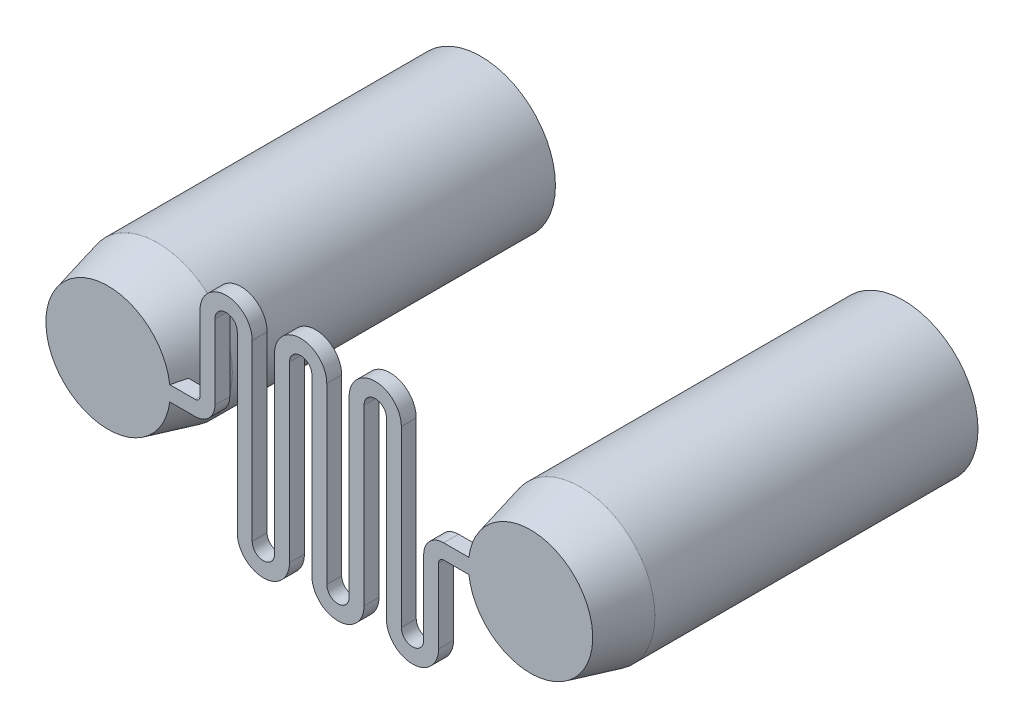
from build123d import *

# Parameters (mm, degrees)
BOSS_EXTRUDE1_DEPTH = 1.2
SKETCH5_R           = 5
CUT_EXTRUDE1_DEPTH  = 28


with BuildPart() as part:
    # Sketch2 → Boss-Extrude1 (new body)
    with BuildSketch(Plane.XY):
        with BuildLine():
            Line((-20.5, -0.6), (-13.5, -0.6))
            ThreePointArc((-13.5, -0.6), (-12.36862915, -0.13137085), (-11.9, 1))
            Line((-11.9, 1), (-11.9, 7))
            ThreePointArc((-11.9, 7), (-11, 7.9), (-10.1, 7))
            Line((-10.1, 7), (-10.1, 0))
            Line((-10.1, 0), (-10.1, -7))
            ThreePointArc((-10.1, -7), (-8, -9.1), (-5.9, -7))
            Line((-5.9, -7), (-5.9, 0))
            Line((-5.9, 0), (-5.9, 7))
            ThreePointArc((-5.9, 7), (-5, 7.9), (-4.1, 7))
            Line((-4.1, 7), (-4.1, 0))
            Line((-4.1, 0), (-4.1, -7))
            ThreePointArc((-4.1, -7), (-2, -9.1), (0.1, -7))
            Line((0.1, -7), (0.1, 0))
            Line((0.1, 0), (0.1, 7))
            ThreePointArc((0.1, 7), (1, 7.9), (1.9, 7))
            Line((1.9, 7), (1.9, 0))
            Line((1.9, 0), (1.9, -7))
            ThreePointArc((1.9, -7), (4, -9.1), (6.1, -7))
            Line((6.1, -7), (6.1, -1))
            ThreePointArc((6.1, -1), (6.217157288, -0.717157288), (6.5, -0.6))
            Line((6.5, -0.6), (13.5, -0.6))
            ThreePointArc((13.5, -0.6), (14.1, 0), (13.5, 0.6))
            Line((13.5, 0.6), (6.5, 0.6))
            ThreePointArc((6.5, 0.6), (5.36862915, 0.13137085), (4.9, -1))
            Line((4.9, -1), (4.9, -7))
            ThreePointArc((4.9, -7), (4, -7.9), (3.1, -7))
            Line((3.1, -7), (3.1, 0))
            Line((3.1, 0), (3.1, 7))
            ThreePointArc((3.1, 7), (1, 9.1), (-1.1, 7))
            Line((-1.1, 7), (-1.1, 0))
            Line((-1.1, 0), (-1.1, -7))
            ThreePointArc((-1.1, -7), (-2, -7.9), (-2.9, -7))
            Line((-2.9, -7), (-2.9, 0))
            Line((-2.9, 0), (-2.9, 7))
            ThreePointArc((-2.9, 7), (-5, 9.1), (-7.1, 7))
            Line((-7.1, 7), (-7.1, 0))
            Line((-7.1, 0), (-7.1, -7))
            ThreePointArc((-7.1, -7), (-8, -7.9), (-8.9, -7))
            Line((-8.9, -7), (-8.9, 0))
            Line((-8.9, 0), (-8.9, 7))
            ThreePointArc((-8.9, 7), (-11, 9.1), (-13.1, 7))
            Line((-13.1, 7), (-13.1, 1))
            ThreePointArc((-13.1, 1), (-13.217157288, 0.717157288), (-13.5, 0.6))
            Line((-13.5, 0.6), (-20.5, 0.6))
            ThreePointArc((-20.5, 0.6), (-21.1, 0), (-20.5, -0.6))
        make_face()
    extrude(amount=BOSS_EXTRUDE1_DEPTH)

    # Sketch3 → Revolve1 (revolve)
    with BuildSketch(Plane(origin=(0, 0, 0), x_dir=(1, 0, 0), z_dir=(0, 1, 0)), mode=Mode.PRIVATE) as revolve1_sk:
        Polygon((-20.5, -1.2), (-25.5, -1.2), (-26.5, 2.8), (-26.5, 28.8), (-20.5, 28.8), align=None)
    revolve(revolve1_sk.sketch.rotate(Axis((-20.5, 0, 1.2), (0, 0, -1)), 186.892102606), axis=Axis((-20.5, 0, 1.2), (0, 0, -1)))

    # Sketch4 → Revolve2 (revolve)
    with BuildSketch(Plane(origin=(0, 0, 0), x_dir=(1, 0, 0), z_dir=(0, 1, 0)), mode=Mode.PRIVATE) as revolve2_sk:
        Polygon((13.5, -1.2), (18.5, -1.2), (19.5, 2.8), (19.5, 28.8), (13.5, 28.8), align=None)
    revolve(revolve2_sk.sketch.rotate(Axis((13.5, 0, 1.2), (0, 0, -1)), 173.499750263), axis=Axis((13.5, 0, 1.2), (0, 0, -1)))

    # Sketch5 → Cut-Extrude1 (cut)
    with BuildSketch(Plane(origin=(0, 0, -28.8), x_dir=(-1, 0, 0), z_dir=(0, 0, -1))):
        with Locations((20.5, 0)):
            Circle(SKETCH5_R)
        with Locations((-13.5, 0)):
            Circle(SKETCH5_R)
    extrude(amount=-CUT_EXTRUDE1_DEPTH, mode=Mode.SUBTRACT)


solid = part.part
